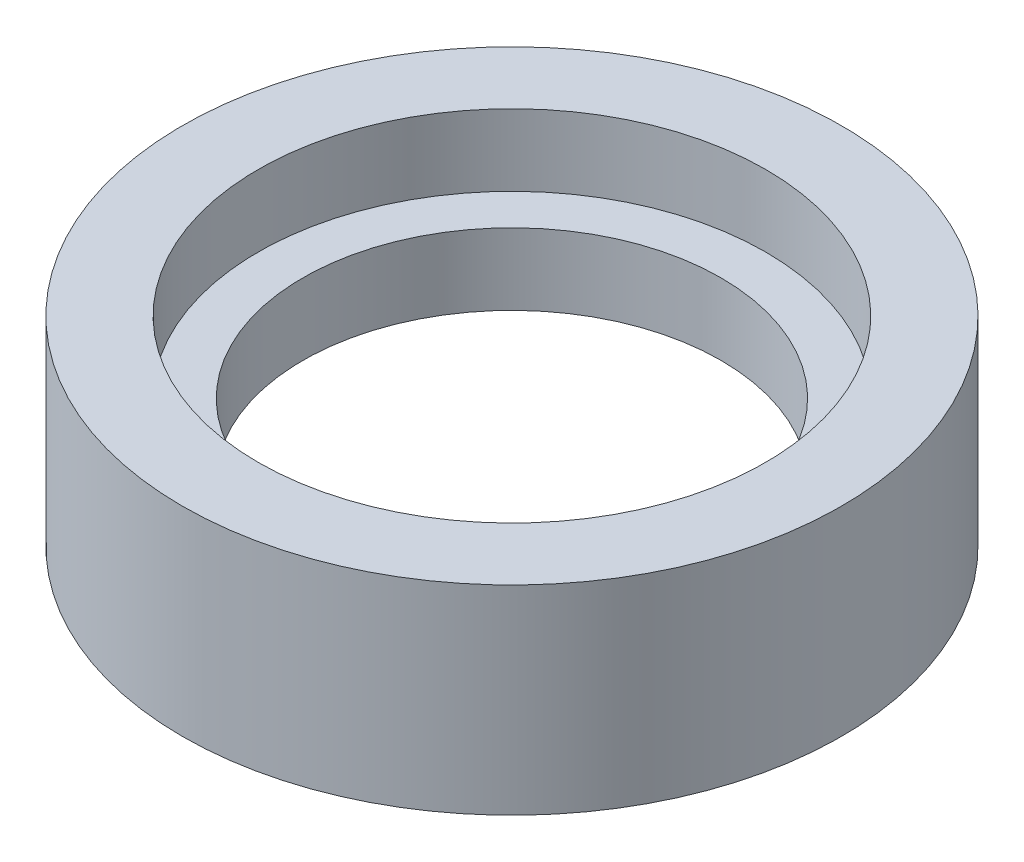
from build123d import *


with BuildPart() as part:
    # Esquisse1 → Révolution1 (revolve)
    with BuildSketch(Plane.XY, mode=Mode.PRIVATE) as r_volution1_sk:
        Polygon((-20.459011997, 0), (-20.459011997, 7), (-24.829467191, 7), (-24.829467191, 14), (-32.25, 14), (-32.25, -5.515393911), (-29.25, -5.515393911), (-29.25, 0), align=None)
    revolve(r_volution1_sk.sketch.rotate(Axis((0, 39.613595536, 0), (0, -1, 0)), 270), axis=Axis((0, 39.613595536, 0), (0, -1, 0)))


solid = part.part
